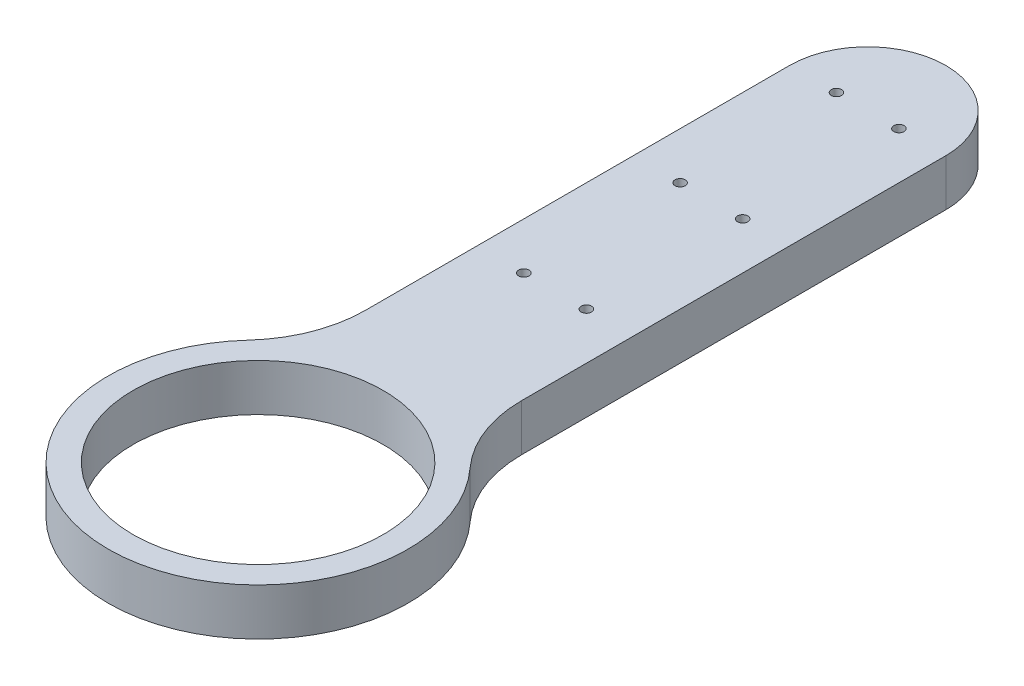
from build123d import *

# Parameters (mm, degrees)
SKETCH1_R           = 39.9935
BOSS_EXTRUDE1_DEPTH = 15
SKETCH2_R           = 1.65
CUT_EXTRUDE1_DEPTH  = 15


with BuildPart() as part:
    # Sketch1 → Boss-Extrude1 (new body)
    with BuildSketch(Plane(origin=(0, 0, 0), x_dir=(1, 0, 0), z_dir=(0, 1, 0))):
        with BuildLine():
            Line((25, 59.311516944), (25, 195))
            ThreePointArc((25, 195), (0, 220), (-25, 195))
            Line((-25, 195), (-25, 59.311516944))
            ThreePointArc((-25, 59.311516944), (-27.704521174, 44.853050249), (-35.452362959, 32.349745021))
            ThreePointArc((-35.452362959, 32.349745021), (0, -47.9935), (35.452362959, 32.349745021))
            ThreePointArc((35.452362959, 32.349745021), (27.704521174, 44.853050249), (25, 59.311516944))
        make_face()
        with Locations(Location((0, 0, 0), (0, 0, 270))):
            Circle(SKETCH1_R, mode=Mode.SUBTRACT)
    extrude(amount=BOSS_EXTRUDE1_DEPTH)

    # Sketch2 → Cut-Extrude1 (cut)
    with BuildSketch(Plane.XZ):
        with Locations(Location((10, -95, 0), (0, 0, 270))):
            Circle(SKETCH2_R)
        with Locations(Location((-10, -95, 0), (0, 0, 270))):
            Circle(SKETCH2_R)
        with Locations(Location((10, -145, 0), (0, 0, 270))):
            Circle(SKETCH2_R)
        with Locations(Location((-10, -145, 0), (0, 0, 270))):
            Circle(SKETCH2_R)
        with Locations(Location((10, -195, 0), (0, 0, 270))):
            Circle(SKETCH2_R)
        with Locations(Location((-10, -195, 0), (0, 0, 270))):
            Circle(SKETCH2_R)
    extrude(amount=-CUT_EXTRUDE1_DEPTH, mode=Mode.SUBTRACT)


solid = part.part
